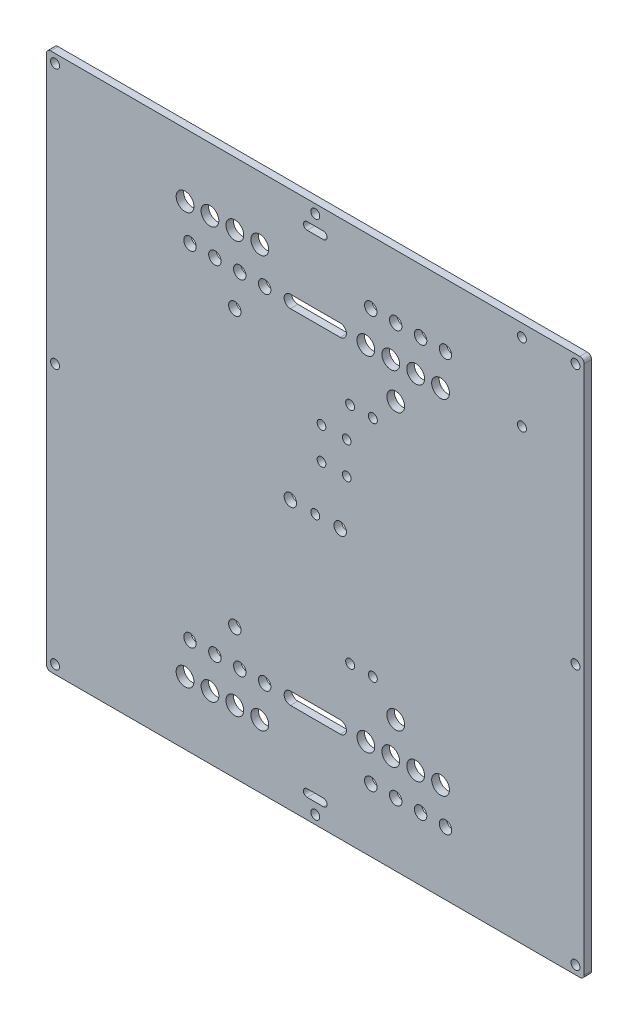
from build123d import *

# Parameters (mm, degrees)
ESQUISSE1_R        = 1.8
ESQUISSE1_R_2      = 3.57
ESQUISSE1_R_3      = 2.5
ESQUISSE1_R_4      = 1.75
BOSS_EXTRU_1_DEPTH = 1.5


with BuildPart() as part:
    # Esquisse1 → Boss.-Extru.1 (new, symmetric)
    with BuildSketch(Plane.XY):
        with BuildLine():
            Line((-106.25, -108), (106.25, -108))
            ThreePointArc((106.25, -108), (107.487436867, -107.487436867), (108, -106.25))
            Line((108, -106.25), (108, 106.25))
            ThreePointArc((108, 106.25), (107.487436867, 107.487436867), (106.25, 108))
            Line((106.25, 108), (-106.25, 108))
            ThreePointArc((-106.25, 108), (-107.487436867, 107.487436867), (-108, 106.25))
            Line((-108, 106.25), (-108, -106.25))
            ThreePointArc((-108, -106.25), (-107.487436867, -107.487436867), (-106.25, -108))
        make_face()
        with Locations((-104.5, 104.5)):
            Circle(ESQUISSE1_R, mode=Mode.SUBTRACT)
        with Locations((0, 104.5)):
            Circle(ESQUISSE1_R, mode=Mode.SUBTRACT)
        with Locations((104.5, 104.5)):
            Circle(ESQUISSE1_R, mode=Mode.SUBTRACT)
        with Locations((-104.5, 0)):
            Circle(ESQUISSE1_R, mode=Mode.SUBTRACT)
        Circle(ESQUISSE1_R, mode=Mode.SUBTRACT)
        with Locations((104.5, 0)):
            Circle(ESQUISSE1_R, mode=Mode.SUBTRACT)
        with Locations((-104.5, -104.5)):
            Circle(ESQUISSE1_R, mode=Mode.SUBTRACT)
        with Locations((0, -104.5)):
            Circle(ESQUISSE1_R, mode=Mode.SUBTRACT)
        with Locations((104.5, -104.5)):
            Circle(ESQUISSE1_R, mode=Mode.SUBTRACT)
        with Locations((-52.3, -82.65)):
            Circle(ESQUISSE1_R_2, mode=Mode.SUBTRACT)
        with Locations((-42.3, -82.65)):
            Circle(ESQUISSE1_R_2, mode=Mode.SUBTRACT)
        with Locations((-32.3, -82.65)):
            Circle(ESQUISSE1_R_2, mode=Mode.SUBTRACT)
        with Locations((-22.3, -82.65)):
            Circle(ESQUISSE1_R_2, mode=Mode.SUBTRACT)
        with Locations((-50.32, -69)):
            Circle(ESQUISSE1_R_3, mode=Mode.SUBTRACT)
        with Locations((-40.32, -69)):
            Circle(ESQUISSE1_R_3, mode=Mode.SUBTRACT)
        with Locations((-30.32, -69)):
            Circle(ESQUISSE1_R_3, mode=Mode.SUBTRACT)
        with Locations((-20.32, -69)):
            Circle(ESQUISSE1_R_3, mode=Mode.SUBTRACT)
        with Locations((42.3, -82.65)):
            Circle(ESQUISSE1_R_3, mode=Mode.SUBTRACT)
        with Locations((32.3, -82.65)):
            Circle(ESQUISSE1_R_3, mode=Mode.SUBTRACT)
        with Locations((22.3, -82.65)):
            Circle(ESQUISSE1_R_3, mode=Mode.SUBTRACT)
        with Locations((52.3, -82.65)):
            Circle(ESQUISSE1_R_3, mode=Mode.SUBTRACT)
        with Locations((50.32, -69)):
            Circle(ESQUISSE1_R_2, mode=Mode.SUBTRACT)
        with Locations((40.32, -69)):
            Circle(ESQUISSE1_R_2, mode=Mode.SUBTRACT)
        with Locations((30.32, -69)):
            Circle(ESQUISSE1_R_2, mode=Mode.SUBTRACT)
        with Locations((20.32, -69)):
            Circle(ESQUISSE1_R_2, mode=Mode.SUBTRACT)
        with Locations((-32.3, -55.35)):
            Circle(ESQUISSE1_R_3, mode=Mode.SUBTRACT)
        with Locations((32.3, -55.35)):
            Circle(ESQUISSE1_R_2, mode=Mode.SUBTRACT)
        with Locations((14, -45)):
            Circle(ESQUISSE1_R, mode=Mode.SUBTRACT)
        with Locations((23.12, -45)):
            Circle(ESQUISSE1_R, mode=Mode.SUBTRACT)
        with Locations((-10, 0)):
            Circle(ESQUISSE1_R_3, mode=Mode.SUBTRACT)
        with Locations((10, 0)):
            Circle(ESQUISSE1_R_3, mode=Mode.SUBTRACT)
        with Locations((2.5, 32.3)):
            Circle(ESQUISSE1_R_4, mode=Mode.SUBTRACT)
        with Locations((12.64, 32.3)):
            Circle(ESQUISSE1_R_4, mode=Mode.SUBTRACT)
        with Locations((2.5, 19.47)):
            Circle(ESQUISSE1_R_4, mode=Mode.SUBTRACT)
        with Locations((12.64, 19.47)):
            Circle(ESQUISSE1_R_4, mode=Mode.SUBTRACT)
        with Locations(Location((23.12, 45, 0), (0, 0, 180))):
            Circle(ESQUISSE1_R, mode=Mode.SUBTRACT)
        with Locations(Location((14, 45, 0), (0, 0, 180))):
            Circle(ESQUISSE1_R, mode=Mode.SUBTRACT)
        with Locations(Location((32.3, 55.35, 0), (0, 0, 180))):
            Circle(ESQUISSE1_R_2, mode=Mode.SUBTRACT)
        with Locations(Location((-32.3, 55.35, 0), (0, 0, 180))):
            Circle(ESQUISSE1_R_3, mode=Mode.SUBTRACT)
        with Locations(Location((20.32, 69, 0), (0, 0, 180))):
            Circle(ESQUISSE1_R_2, mode=Mode.SUBTRACT)
        with Locations(Location((30.32, 69, 0), (0, 0, 180))):
            Circle(ESQUISSE1_R_2, mode=Mode.SUBTRACT)
        with Locations(Location((40.32, 69, 0), (0, 0, 180))):
            Circle(ESQUISSE1_R_2, mode=Mode.SUBTRACT)
        with Locations(Location((50.32, 69, 0), (0, 0, 180))):
            Circle(ESQUISSE1_R_2, mode=Mode.SUBTRACT)
        with Locations(Location((52.3, 82.65, 0), (0, 0, 180))):
            Circle(ESQUISSE1_R_3, mode=Mode.SUBTRACT)
        with Locations(Location((22.3, 82.65, 0), (0, 0, 180))):
            Circle(ESQUISSE1_R_3, mode=Mode.SUBTRACT)
        with Locations(Location((32.3, 82.65, 0), (0, 0, 180))):
            Circle(ESQUISSE1_R_3, mode=Mode.SUBTRACT)
        with Locations(Location((42.3, 82.65, 0), (0, 0, 180))):
            Circle(ESQUISSE1_R_3, mode=Mode.SUBTRACT)
        with Locations(Location((-20.32, 69, 0), (0, 0, 180))):
            Circle(ESQUISSE1_R_3, mode=Mode.SUBTRACT)
        with Locations(Location((-30.32, 69, 0), (0, 0, 180))):
            Circle(ESQUISSE1_R_3, mode=Mode.SUBTRACT)
        with Locations(Location((-40.32, 69, 0), (0, 0, 180))):
            Circle(ESQUISSE1_R_3, mode=Mode.SUBTRACT)
        with Locations(Location((-50.32, 69, 0), (0, 0, 180))):
            Circle(ESQUISSE1_R_3, mode=Mode.SUBTRACT)
        with Locations(Location((-22.3, 82.65, 0), (0, 0, 180))):
            Circle(ESQUISSE1_R_2, mode=Mode.SUBTRACT)
        with Locations(Location((-32.3, 82.65, 0), (0, 0, 180))):
            Circle(ESQUISSE1_R_2, mode=Mode.SUBTRACT)
        with Locations(Location((-42.3, 82.65, 0), (0, 0, 180))):
            Circle(ESQUISSE1_R_2, mode=Mode.SUBTRACT)
        with Locations(Location((-52.3, 82.65, 0), (0, 0, 180))):
            Circle(ESQUISSE1_R_2, mode=Mode.SUBTRACT)
        with Locations((83, 103)):
            Circle(ESQUISSE1_R, mode=Mode.SUBTRACT)
        with Locations((83, 72)):
            Circle(ESQUISSE1_R, mode=Mode.SUBTRACT)
        with BuildLine():
            Line((-3.25, -97.12), (3.25, -97.12))
            ThreePointArc((3.25, -97.12), (4.75, -98.62), (3.25, -100.12))
            Line((3.25, -100.12), (-3.25, -100.12))
            ThreePointArc((-3.25, -100.12), (-4.75, -98.62), (-3.25, -97.12))
        make_face(mode=Mode.SUBTRACT)
        with BuildLine():
            Line((-10, -66.5), (10, -66.5))
            ThreePointArc((10, -66.5), (12.5, -69), (10, -71.5))
            Line((10, -71.5), (-10, -71.5))
            ThreePointArc((-10, -71.5), (-12.5, -69), (-10, -66.5))
        make_face(mode=Mode.SUBTRACT)
        with BuildLine():
            Line((-3.25, 97.12), (3.25, 97.12))
            ThreePointArc((3.25, 97.12), (4.75, 98.62), (3.25, 100.12))
            Line((3.25, 100.12), (-3.25, 100.12))
            ThreePointArc((-3.25, 100.12), (-4.75, 98.62), (-3.25, 97.12))
        make_face(mode=Mode.SUBTRACT)
        with BuildLine():
            Line((-10, 66.5), (10, 66.5))
            ThreePointArc((10, 66.5), (12.5, 69), (10, 71.5))
            Line((10, 71.5), (-10, 71.5))
            ThreePointArc((-10, 71.5), (-12.5, 69), (-10, 66.5))
        make_face(mode=Mode.SUBTRACT)
    extrude(amount=BOSS_EXTRU_1_DEPTH, both=True)


solid = part.part
